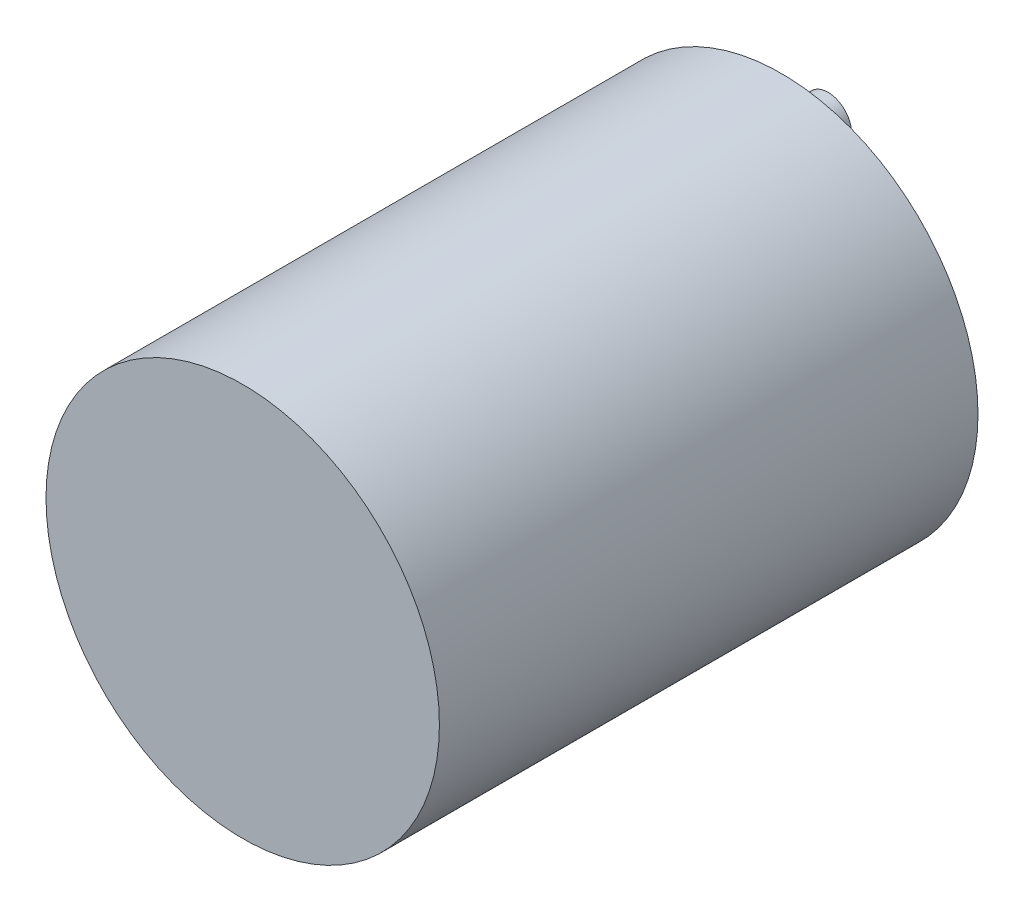
from build123d import *

# Parameters (mm, degrees)
SKETCH1_R           = 21
BOSS_EXTRUDE1_DEPTH = 57.5
SKETCH2_R           = 2.5
BOSS_EXTRUDE2_DEPTH = 5


with BuildPart() as part:
    # Sketch1 → Boss-Extrude1 (new body)
    with BuildSketch(Plane.XY):
        Circle(SKETCH1_R)
    extrude(amount=BOSS_EXTRUDE1_DEPTH)

    # Sketch2 → Boss-Extrude2 (add)
    with BuildSketch(Plane.XY):
        with Locations((0, 14.25)):
            Circle(SKETCH2_R)
        with Locations((12.340862004, -7.125)):
            Circle(SKETCH2_R)
        with Locations((-12.340862004, -7.125)):
            Circle(SKETCH2_R)
    extrude(amount=-BOSS_EXTRUDE2_DEPTH)


solid = part.part
